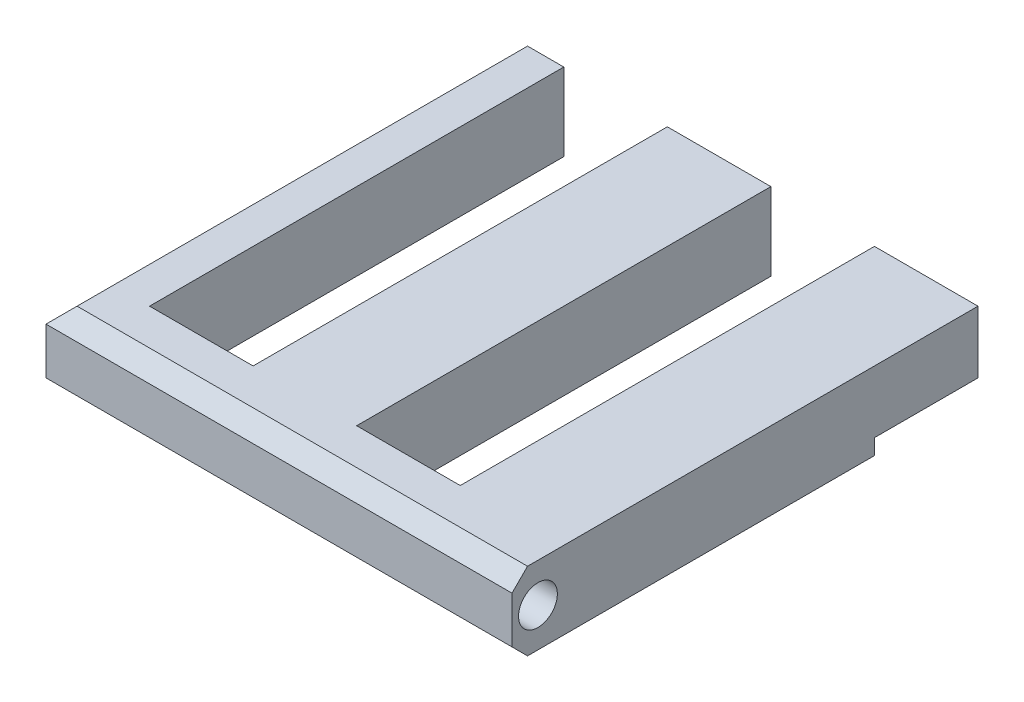
from build123d import *

# Parameters (mm, degrees)
SKETCH1_W           = 50.8
SKETCH1_H           = 203.2
BOSS_EXTRUDE2_DEPTH = 38.1
SKETCH2_R           = 9.525
CUT_EXTRUDE1_DEPTH  = 38.1
SKETCH3_R           = 9.525
CUT_EXTRUDE2_DEPTH  = 38.1
SKETCH4_W           = 253.975113334
SKETCH4_H           = 254.028971003
CUT_EXTRUDE3_DEPTH  = 7.62
SKETCH5_W           = 254
SKETCH5_H           = 254.028971003
CUT_EXTRUDE4_DEPTH  = 60.96
SKETCH6_W           = 50.8
SKETCH6_H           = 50.828971003
BOSS_EXTRUDE3_DEPTH = 7.62
CHAMFER1_SIZE       = 7.62


with BuildPart() as part:
    # Sketch1 → Boss-Extrude2 (new body)
    with BuildSketch(Plane(origin=(0, 0, 0), x_dir=(1, 0, 0), z_dir=(0, 1, 0))):
        Polygon((0, 0), (0, 25.4), (-50.8, 25.4), (-101.6, 25.4), (-152.4, 25.4), (-203.2, 25.4), (-203.2, 228.6), (-228.6, 228.6), (-228.6, 0), align=None)
        with Locations((-127, 127)):
            Rectangle(SKETCH1_W, SKETCH1_H)
        with Locations((-25.4, 127)):
            Rectangle(SKETCH1_W, SKETCH1_H)
    extrude(amount=BOSS_EXTRUDE2_DEPTH)

    # Sketch2 → Cut-Extrude1 (cut)
    with BuildSketch(Plane(origin=(0, 0, -228.6), x_dir=(-1, 0, 0), z_dir=(0, 0, -1))):
        with Locations((215.9, 19.05)):
            Circle(SKETCH2_R)
    extrude(amount=-CUT_EXTRUDE1_DEPTH, mode=Mode.SUBTRACT)

    # Sketch3 → Cut-Extrude2 (cut)
    with BuildSketch(Plane(origin=(0, 0, 0), x_dir=(0, 0, -1), z_dir=(1, 0, 0))):
        with Locations((12.728971003, 19.05)):
            Circle(SKETCH3_R)
    extrude(amount=-CUT_EXTRUDE2_DEPTH, mode=Mode.SUBTRACT)

    # Sketch4 → Cut-Extrude3 (cut)
    with BuildSketch(Plane(origin=(0, 7.62, 0), x_dir=(-1, 0, 0), z_dir=(0, -1, 0))):
        with Locations((-50.812443333, 304.785514498)):
            Rectangle(SKETCH4_W, SKETCH4_H)
    extrude(amount=-CUT_EXTRUDE3_DEPTH, mode=Mode.SUBTRACT)

    # Sketch5 → Cut-Extrude4 (cut)
    with BuildSketch(Plane.XZ.offset(-7.62)):
        with Locations((50.8, -304.785514498)):
            Rectangle(SKETCH5_W, SKETCH5_H)
    extrude(amount=CUT_EXTRUDE4_DEPTH, mode=Mode.SUBTRACT)

    # Sketch6 → Boss-Extrude3 (add)
    with BuildSketch(Plane(origin=(0, 15.24, 0), x_dir=(-1, 0, 0), z_dir=(0, -1, 0))):
        with Locations((25.4, 203.185514499)):
            Rectangle(SKETCH6_W, SKETCH6_H)
    extrude(amount=BOSS_EXTRUDE3_DEPTH)

    # Chamfer1
    chamfer1_edges = [part.edges().sort_by_distance(p)[0] for p in [
        (-114.3, 0, 0),
        (-228.6, 0, -114.3),
        (-228.6, 38.1, -114.3),
        (-114.3, 38.1, 0),
    ]]
    chamfer(chamfer1_edges, length=CHAMFER1_SIZE)


solid = part.part
